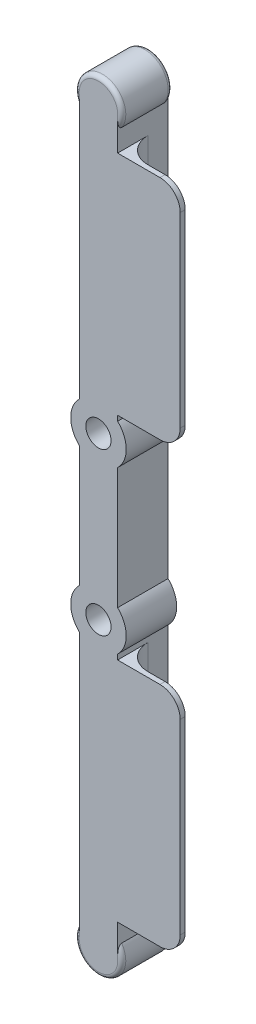
from build123d import *

# Parameters (mm, degrees)
SKETCH1_R            = 2.5
BOSS_EXTRUDE1_DEPTH  = 10
SKETCH4_W            = 20
SKETCH4_H            = 45
BOSS_EXTRUDE2_DEPTH  = 1
FILLET3_R            = 0.8
FILLET2_R            = 4
FILLET1_R            = 5
FILLET3_OF_MIRROR1_R = 0.8
FILLET2_OF_MIRROR1_R = 4
FILLET1_OF_MIRROR1_R = 5


with BuildPart() as part:
    # Sketch1 → Boss-Extrude1 (new body)
    with BuildSketch(Plane.XY):
        with BuildLine():
            Line((-3.8, 6), (-3.8, -44.02382093))
            ThreePointArc((-3.8, -44.02382093), (-5.5, -48), (-3.8, -51.97617907))
            Line((-3.8, -51.97617907), (-3.8, -64))
            Line((-3.8, -64), (3.8, -64))
            Line((3.8, -64), (3.8, -51.97617907))
            ThreePointArc((3.8, -51.97617907), (5.5, -48), (3.8, -44.02382093))
            Line((3.8, -44.02382093), (3.8, 6))
            ThreePointArc((3.8, 6), (0, 13.252645761), (-3.8, 6))
        make_face()
        with Locations((0, -48)):
            Circle(SKETCH1_R, mode=Mode.SUBTRACT)
    boss_extrude1 = extrude(amount=BOSS_EXTRUDE1_DEPTH)

    # Sketch4 → Boss-Extrude2 (add)
    with BuildSketch(Plane.XY.offset(10)):
        with Locations((6.2, -20.5)):
            Rectangle(SKETCH4_W, SKETCH4_H)
    boss_extrude2 = extrude(amount=-BOSS_EXTRUDE2_DEPTH)

    # Fillet3
    fillet3_edges = [part.edges().sort_by_distance(p)[0] for p in [
        (0, 13.252645761, 0),
        (0, 13.252645761, 10),
    ]]
    fillet(fillet3_edges, radius=FILLET3_R)

    # Fillet2
    fillet2_edges = [part.edges().sort_by_distance(p)[0] for p in [
        (16.2, -43, 9.5),
        (16.2, 2, 9.5),
    ]]
    fillet(fillet2_edges, radius=FILLET2_R)

    # Fillet1
    fillet1_edges = [part.edges().sort_by_distance(p)[0] for p in [
        (3.8, -20.5, 9),
    ]]
    fillet(fillet1_edges, radius=FILLET1_R)

    # Mirror1: Boss-Extrude1, Boss-Extrude2 across plane
    add(boss_extrude1.mirror(Plane(origin=(0, -64, 0), x_dir=(0, 0, 1), z_dir=(0, -1, 0))))
    add(boss_extrude2.mirror(Plane(origin=(0, -64, 0), x_dir=(0, 0, 1), z_dir=(0, -1, 0))))

    # Fillet3 of Mirror1
    fillet3_of_mirror1_edges = [part.edges().sort_by_distance(p)[0] for p in [
        (0, -141.252645761, 0),
        (0, -141.252645761, 10),
    ]]
    fillet(fillet3_of_mirror1_edges, radius=FILLET3_OF_MIRROR1_R)

    # Fillet2 of Mirror1
    fillet2_of_mirror1_edges = [part.edges().sort_by_distance(p)[0] for p in [
        (16.2, -85, 9.5),
        (16.2, -130, 9.5),
    ]]
    fillet(fillet2_of_mirror1_edges, radius=FILLET2_OF_MIRROR1_R)

    # Fillet1 of Mirror1
    fillet1_of_mirror1_edges = [part.edges().sort_by_distance(p)[0] for p in [
        (3.8, -107.5, 9),
    ]]
    fillet(fillet1_of_mirror1_edges, radius=FILLET1_OF_MIRROR1_R)


solid = part.part
